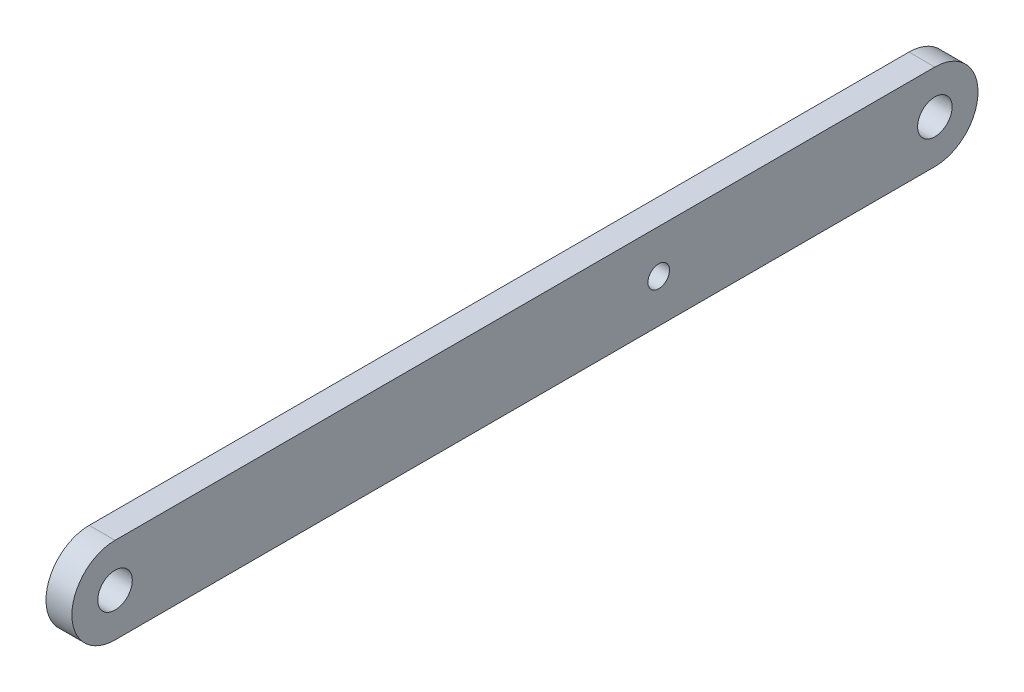
from build123d import *

# Parameters (mm, degrees)
SKETCH1_R           = 2
SKETCH1_R_2         = 1.25
BOSS_EXTRUDE1_DEPTH = 3


with BuildPart() as part:
    # Sketch1 → Boss-Extrude1 (new body)
    with BuildSketch(Plane(origin=(0, 0, 0), x_dir=(0, 0, -1), z_dir=(1, 0, 0))):
        with BuildLine():
            Line((0, 0), (95, 0))
            ThreePointArc((95, 0), (100, 5), (95, 10))
            Line((95, 10), (0, 10))
            ThreePointArc((0, 10), (-5, 5), (0, 0))
        make_face()
        with Locations((0, 5)):
            Circle(SKETCH1_R, mode=Mode.SUBTRACT)
        with Locations((95, 5)):
            Circle(SKETCH1_R, mode=Mode.SUBTRACT)
        with Locations((63, 5)):
            Circle(SKETCH1_R_2, mode=Mode.SUBTRACT)
    extrude(amount=BOSS_EXTRUDE1_DEPTH)


solid = part.part
